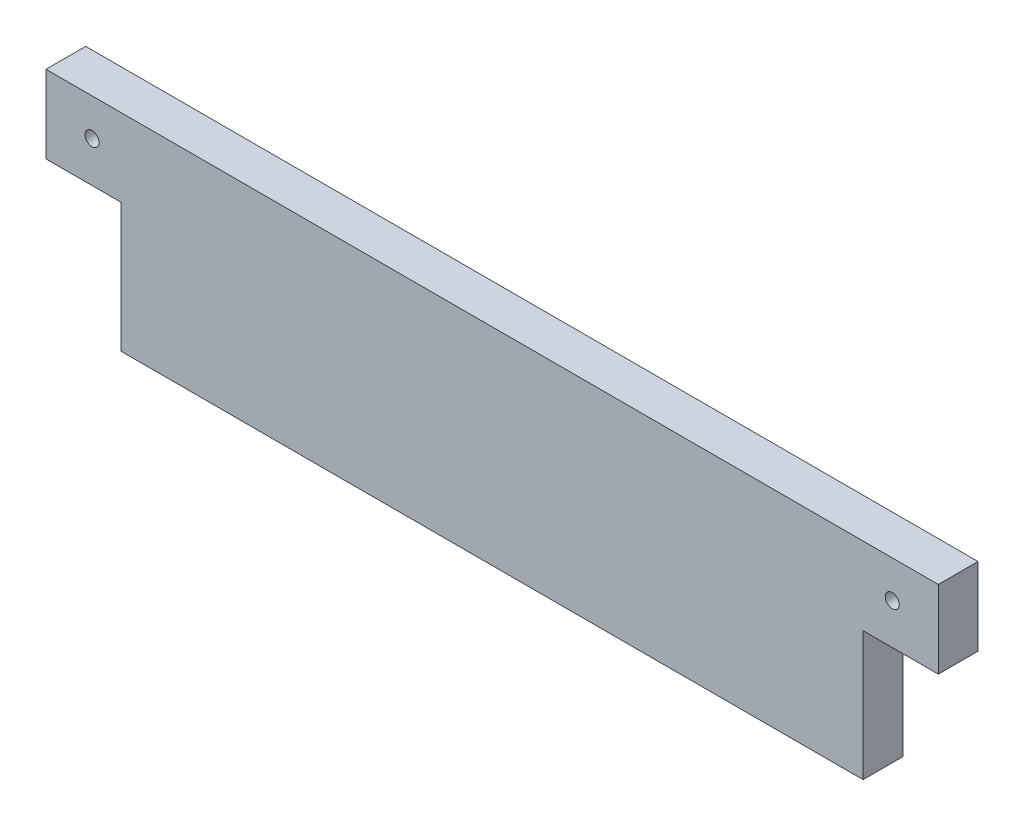
from build123d import *

# Parameters (mm, degrees)
SKETCH2_W           = 19.05
SKETCH2_H           = 37.278922504
BOSS_EXTRUDE1_DEPTH = 428.225
BOSS_EXTRUDE2_DEPTH = 356
SKETCH6_R           = 3.3655
CUT_EXTRUDE1_DEPTH  = 25.4


with BuildPart() as part:
    # Sketch2 → Boss-Extrude1 (new body)
    with BuildSketch(Plane.ZY.offset(11.1125)):
        with Locations((9.525, 246.563328153)):
            Rectangle(SKETCH2_W, SKETCH2_H)
    extrude(amount=-BOSS_EXTRUDE1_DEPTH)

    # Sketch5 → Boss-Extrude2 (add)
    with BuildSketch(Plane.ZY.offset(-381)):
        Polygon((19.05, 227.923866901), (0, 227.923866901), (0, 201.997670401), (19.05, 224.857670401), align=None)
        Polygon((19.05, 224.857670401), (0, 201.997670401), (0, 192.286298431), (19.05, 215.146298431), align=None)
        Polygon((19.05, 215.146298431), (0, 192.286298431), (0, 166.012618521), (19.05, 188.872618521), align=None)
        Polygon((0, 166.012618521), (19.05, 166.012618521), (19.05, 188.872618521), align=None)
    extrude(amount=BOSS_EXTRUDE2_DEPTH)

    # Sketch6 → Cut-Extrude1 (cut)
    with BuildSketch(Plane(origin=(203, 213.395866862, -1.905), x_dir=(-1, 0, 0), z_dir=(0, 0, -1))):
        with Locations(Location((192.0145, 34.026922543, 0), (0, 0, 90))):
            Circle(SKETCH6_R)
    cut_extrude1 = extrude(amount=-CUT_EXTRUDE1_DEPTH, mode=Mode.SUBTRACT)

    # Mirror1: Cut-Extrude1 across plane
    add(cut_extrude1.mirror(Plane.ZY.offset(-203)), mode=Mode.SUBTRACT)


solid = part.part
